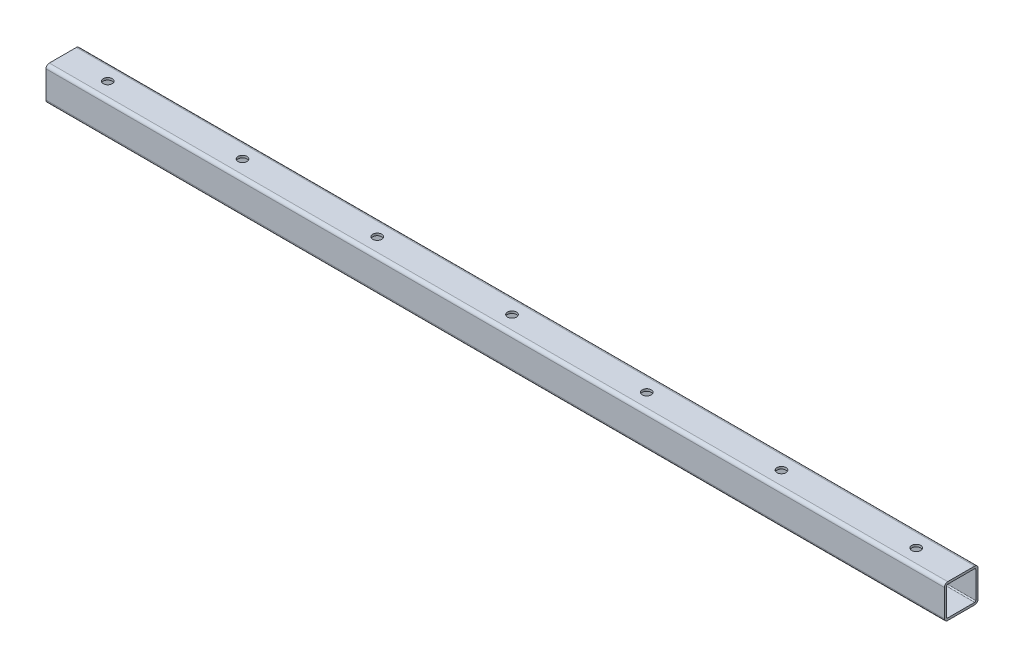
from build123d import *

# Parameters (mm, degrees)
EXTRUDE_1_DEPTH          = 200
CUT_EXTRUDE_1_DEPTH      = 201.281052524
CUT_EXTRUDE_1_DEPTH_BACK = 201.281052524
SKETCH_2_R               = 2


with BuildPart() as part:
    # 草图1 → 凸台-拉伸1 (new, symmetric)
    with BuildSketch(Plane(origin=(0, 0, 0), x_dir=(0, 0, -1), z_dir=(1, 0, 0))):
        with BuildLine():
            Line((6, 7.5), (-6, 7.5))
            ThreePointArc((-6, 7.5), (-7.060660172, 7.060660172), (-7.5, 6))
            Line((-7.5, 6), (-7.5, -6))
            ThreePointArc((-7.5, -6), (-7.060660172, -7.060660172), (-6, -7.5))
            Line((-6, -7.5), (6, -7.5))
            ThreePointArc((6, -7.5), (7.060660172, -7.060660172), (7.5, -6))
            Line((7.5, -6), (7.5, 6))
            ThreePointArc((7.5, 6), (7.060660172, 7.060660172), (6, 7.5))
        make_face()
        with BuildLine():
            Line((6, 6.5), (-6, 6.5))
            ThreePointArc((-6, 6.5), (-6.353553391, 6.353553391), (-6.5, 6))
            Line((-6.5, 6), (-6.5, -6))
            ThreePointArc((-6.5, -6), (-6.353553391, -6.353553391), (-6, -6.5))
            Line((-6, -6.5), (6, -6.5))
            ThreePointArc((6, -6.5), (6.353553391, -6.353553391), (6.5, -6))
            Line((6.5, -6), (6.5, 6))
            ThreePointArc((6.5, 6), (6.353553391, 6.353553391), (6, 6.5))
        make_face(mode=Mode.SUBTRACT)
    extrude(amount=EXTRUDE_1_DEPTH, both=True)

    # 草图2 → 切除-拉伸1 (cut, two sides: drawn at the far end of the back side and taken through both)
    with BuildSketch(Plane(origin=(0, 0, 0), x_dir=(1, 0, 0), z_dir=(0, 1, 0)).offset(-CUT_EXTRUDE_1_DEPTH_BACK)):
        with Locations(Location((-180, 0, 0), (0, 0, 270))):
            Circle(SKETCH_2_R)
        with Locations(Location((-120, 0, 0), (0, 0, 270))):
            Circle(SKETCH_2_R)
        with Locations(Location((-60, 0, 0), (0, 0, 270))):
            Circle(SKETCH_2_R)
        with Locations(Location((0, 0, 0), (0, 0, 270))):
            Circle(SKETCH_2_R)
        with Locations(Location((60, 0, 0), (0, 0, 270))):
            Circle(SKETCH_2_R)
        with Locations(Location((120, 0, 0), (0, 0, 270))):
            Circle(SKETCH_2_R)
        with Locations(Location((180, 0, 0), (0, 0, 270))):
            Circle(SKETCH_2_R)
    extrude(amount=CUT_EXTRUDE_1_DEPTH + CUT_EXTRUDE_1_DEPTH_BACK, mode=Mode.SUBTRACT)


solid = part.part
